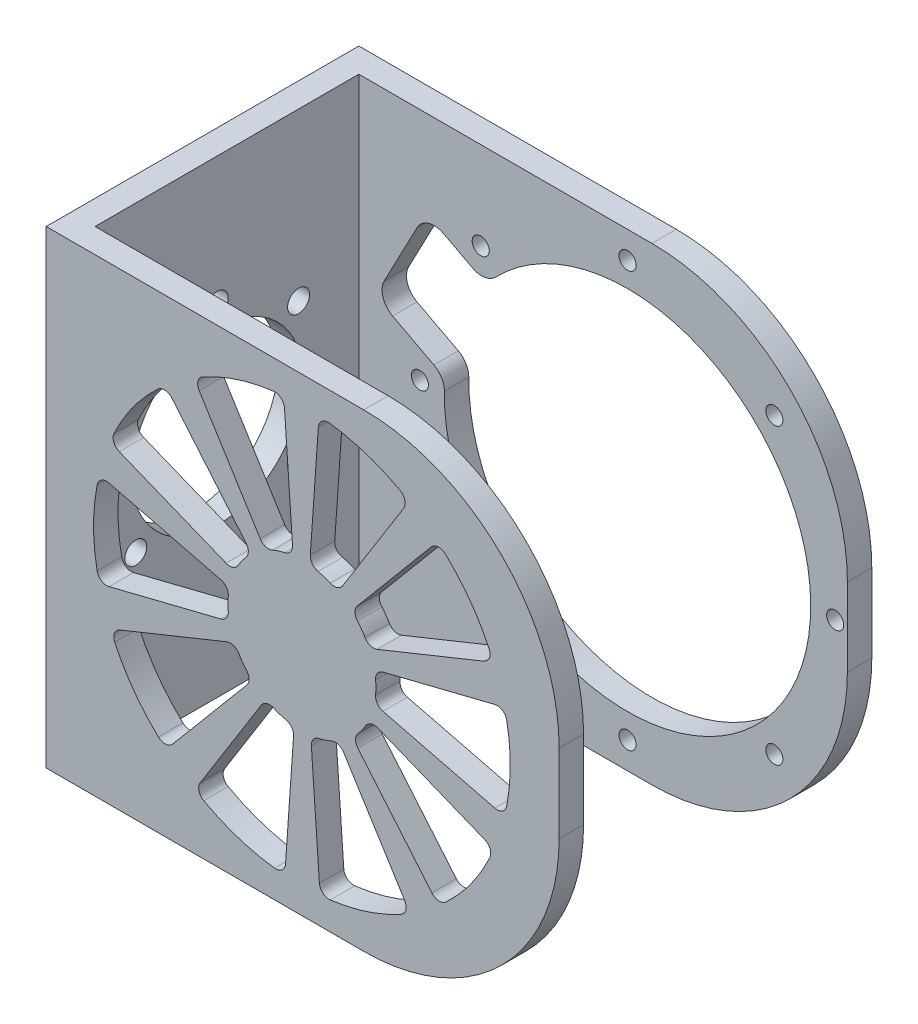
from build123d import *

# Parameters (mm, degrees)
SKETCH_1_W          = 64
SKETCH_1_H          = 96
EXTRUDE_1_DEPTH     = 5
SKETCH_3_W          = 5
SKETCH_3_H          = 96
EXTRUDE_2_DEPTH     = 100
SKETCH_4_R          = 2.25
SKETCH_4_R_2        = 17.5
CUT_EXTRUDE_1_DEPTH = 100
SKETCH_5_R          = 1.75
SKETCH_5_R_2        = 37.5
CUT_EXTRUDE_2_DEPTH = 22
FILLET_1_R          = 40
CUT_EXTRUDE_3_DEPTH = 10
FILLET_2_R          = 4
EXTRUDE_3_DEPTH     = 5
EXTRUDE_4_DEPTH     = 5
CUT_EXTRUDE_4_DEPTH = 5


with BuildPart() as part:
    # 草图1 → 凸台-拉伸1 (new body)
    with BuildSketch(Plane(origin=(0, 0, 0), x_dir=(0, 0, -1), z_dir=(1, 0, 0))):
        Rectangle(SKETCH_1_W, SKETCH_1_H)
    extrude(amount=EXTRUDE_1_DEPTH)

    # 草图3 → 凸台-拉伸2 (add)
    with BuildSketch(Plane(origin=(5, 0, 0), x_dir=(0, 0, -1), z_dir=(1, 0, 0))):
        with Locations((29.5, 0)):
            Rectangle(SKETCH_3_W, SKETCH_3_H)
    extrude(amount=EXTRUDE_2_DEPTH)

    # 草图4 → 切除-拉伸1 (cut)
    with BuildSketch(Plane.ZY):
        with Locations((2, 21.75)):
            Circle(SKETCH_4_R)
        with Locations((18.661466638, 13.980630511)):
            Circle(SKETCH_4_R)
        with Locations(Location((-14.661466638, 13.980630511, 0), (0, 0, 180))):
            Circle(SKETCH_4_R)
        with Locations(Location((2, -21.75, 0), (0, 0, 180))):
            Circle(SKETCH_4_R)
        with Locations(Location((18.661466638, -13.980630511, 0), (0, 0, 180))):
            Circle(SKETCH_4_R)
        with Locations((-14.661466638, -13.980630511)):
            Circle(SKETCH_4_R)
        with Locations((2, 0)):
            Circle(SKETCH_4_R_2)
    extrude(amount=-CUT_EXTRUDE_1_DEPTH, mode=Mode.SUBTRACT)

    # 草图5 → 切除-拉伸2 (cut)
    with BuildSketch(Plane(origin=(0, 0, -32), x_dir=(-1, 0, 0), z_dir=(0, 0, -1))):
        with Locations(Location((-60, 42.5, 0), (0, 0, 90))):
            Circle(SKETCH_5_R)
        with Locations(Location((-29.9479618, 30.0520382, 0), (0, 0, 90))):
            Circle(SKETCH_5_R)
        with Locations(Location((-17.5, 0, 0), (0, 0, 90))):
            Circle(SKETCH_5_R)
        with Locations(Location((-29.9479618, -30.0520382, 0), (0, 0, 90))):
            Circle(SKETCH_5_R)
        with Locations(Location((-60, -42.5, 0), (0, 0, 90))):
            Circle(SKETCH_5_R)
        with Locations(Location((-90.0520382, -30.0520382, 0), (0, 0, 90))):
            Circle(SKETCH_5_R)
        with Locations(Location((-102.5, 0, 0), (0, 0, 90))):
            Circle(SKETCH_5_R)
        with Locations(Location((-90.0520382, 30.0520382, 0), (0, 0, 90))):
            Circle(SKETCH_5_R)
        with Locations(Location((-60, 0, 0), (0, 0, 90))):
            Circle(SKETCH_5_R_2)
    extrude(amount=-CUT_EXTRUDE_2_DEPTH, mode=Mode.SUBTRACT)

    # 圆角1
    fillet_1_edges = [part.edges().sort_by_distance(p)[0] for p in [
        (105, 48, -29.5),
        (105, -48, -29.5),
        (2.5, 48, 32),
        (2.5, -48, 32),
    ]]
    fillet(fillet_1_edges, radius=FILLET_1_R)

    # 草图6 → 切除-拉伸3 (cut)
    with BuildSketch(Plane.XY.offset(-27)):
        with BuildLine():
            Line((10.214665978, 13.994581898), (16.909375695, 26.736126199))
            ThreePointArc((16.909375695, 26.736126199), (19.262083386, 28.695041593), (22.310861308, 28.41658839))
            Line((22.310861308, 28.41658839), (38.87601299, 19.712864625))
            Line((38.87601299, 19.712864625), (28.460279851, -0.11062748))
            Line((28.460279851, -0.11062748), (11.895128168, 8.593096285))
            ThreePointArc((11.895128168, 8.593096285), (9.936212774, 10.945803977), (10.214665978, 13.994581898))
        make_face()
    extrude(amount=-CUT_EXTRUDE_3_DEPTH, mode=Mode.SUBTRACT)

    # 圆角2
    fillet_2_edges = [part.edges().sort_by_distance(p)[0] for p in [
        (31.043675088, 23.82816081, -29.5),
        (22.616971057, 2.959585615, -29.5),
    ]]
    fillet(fillet_2_edges, radius=FILLET_2_R)

    # 草图7 → 凸台-拉伸3 (add)
    with BuildSketch(Plane(origin=(5, 0, 0), x_dir=(0, 0, -1), z_dir=(1, 0, 0))):
        with BuildLine():
            Line((8, 48), (-27, 48))
            Line((-27, 48), (-32, 48))
            Line((-32, 48), (-32, 8))
            ThreePointArc((-32, 8), (-20.284271247, 36.284271247), (8, 48))
        make_face()
        with BuildLine():
            ThreePointArc((8, -48), (-20.284271247, -36.284271247), (-32, -8))
            Line((-32, -8), (-32, -48))
            Line((-32, -48), (-27, -48))
            Line((-27, -48), (8, -48))
        make_face()
    extrude(amount=-EXTRUDE_3_DEPTH)

    # 草图8 → 凸台-拉伸4 (add)
    with BuildSketch(Plane.XY.offset(32)):
        with BuildLine():
            Line((5, -48), (65, -48))
            ThreePointArc((65, -48), (93.284271247, -36.284271247), (105, -8))
            Line((105, -8), (105, 8))
            ThreePointArc((105, 8), (93.284271247, 36.284271247), (65, 48))
            Line((65, 48), (5, 48))
            Line((5, 48), (5, -48))
        make_face()
    extrude(amount=-EXTRUDE_4_DEPTH)

    # 草图9 → 切除-拉伸4 (cut)
    with BuildSketch(Plane.XY.offset(32)):
        with BuildLine():
            Line((68.934811463, 3.474338712), (91.820133988, 9.180290472))
            ThreePointArc((91.820133988, 9.180290472), (93.378826653, 8.926322835), (94.26734503, 7.620735809))
            ThreePointArc((94.26734503, 7.620735809), (95, 0), (94.26734503, -7.620735809))
            ThreePointArc((94.26734503, -7.620735809), (93.378826653, -8.926322835), (91.820133988, -9.180290472))
            Line((91.820133988, -9.180290472), (68.934811463, -3.474338712))
            ThreePointArc((68.934811463, -3.474338712), (67.77963213, -2.679872557), (67.429875219, -1.322195913))
            ThreePointArc((67.429875219, -1.322195913), (67.5, 0), (67.429875219, 1.322195913))
            ThreePointArc((67.429875219, 1.322195913), (67.77963213, 2.679872557), (68.934811463, 3.474338712))
        make_face()
        with BuildLine():
            Line((67.875366835, -6.960104882), (89.743855973, -15.795548013))
            ThreePointArc((89.743855973, -15.795548013), (90.855586398, -16.917188709), (90.807008065, -18.495688799))
            ThreePointArc((90.807008065, -18.495688799), (86.920382266, -25.091637364), (81.848295824, -30.826298358))
            ThreePointArc((81.848295824, -30.826298358), (80.362064559, -31.360282451), (78.951777271, -30.649570023))
            Line((78.951777271, -30.649570023), (63.791036722, -12.581703006))
            ThreePointArc((63.791036722, -12.581703006), (63.323452499, -11.259969009), (63.838515523, -9.956003578))
            ThreePointArc((63.838515523, -9.956003578), (64.672414921, -8.927542926), (65.39285004, -7.816645651))
            ThreePointArc((65.39285004, -7.816645651), (66.473831633, -6.923844127), (67.875366835, -6.960104882))
        make_face()
        with BuildLine():
            Line((60.885046066, -14.779021148), (73.38368225, -34.7810202))
            ThreePointArc((73.38368225, -34.7810202), (73.623807197, -36.341905332), (72.656687427, -37.590385103))
            ThreePointArc((72.656687427, -37.590385103), (65.635339813, -40.642118261), (58.161186526, -42.300258852))
            ThreePointArc((58.161186526, -42.300258852), (56.644932199, -41.858676239), (55.921732101, -40.454751738))
            Line((55.921732101, -40.454751738), (54.276461122, -16.926280561))
            ThreePointArc((54.276461122, -16.926280561), (54.67507329, -15.582136185), (55.85821968, -14.82995244))
            ThreePointArc((55.85821968, -14.82995244), (57.137372468, -14.488064063), (58.373185758, -14.012790426))
            ThreePointArc((58.373185758, -14.012790426), (59.772493806, -13.925883859), (60.885046066, -14.779021148))
        make_face()
        with BuildLine():
            Line((50.633914097, -16.995849828), (48.988643118, -40.524321005))
            ThreePointArc((48.988643118, -40.524321005), (48.265443019, -41.928245506), (46.749188693, -42.36982812))
            ThreePointArc((46.749188693, -42.36982812), (39.275035406, -40.711687528), (32.253687792, -37.65995437))
            ThreePointArc((32.253687792, -37.65995437), (31.286568022, -36.4114746), (31.526692969, -34.850589467))
            Line((31.526692969, -34.850589467), (44.025329153, -14.848590416))
            ThreePointArc((44.025329153, -14.848590416), (45.137881413, -13.995453126), (46.537189461, -14.082359693))
            ThreePointArc((46.537189461, -14.082359693), (47.773002751, -14.55763333), (49.052155539, -14.899521708))
            ThreePointArc((49.052155539, -14.899521708), (50.235301929, -15.651705452), (50.633914097, -16.995849828))
        make_face()
        with BuildLine():
            Line((41.037554918, -12.763837713), (25.876814368, -30.83170473))
            ThreePointArc((25.876814368, -30.83170473), (24.466527081, -31.542417157), (22.980295815, -31.008433064))
            ThreePointArc((22.980295815, -31.008433064), (17.908209373, -25.273772071), (14.021583575, -18.677823506))
            ThreePointArc((14.021583575, -18.677823506), (13.973005242, -17.099323416), (15.084735666, -15.97768272))
            Line((15.084735666, -15.97768272), (36.953224805, -7.142239589))
            ThreePointArc((36.953224805, -7.142239589), (38.354760007, -7.105978834), (39.4357416, -7.998780357))
            ThreePointArc((39.4357416, -7.998780357), (40.156176719, -9.109677633), (40.990076117, -10.138138285))
            ThreePointArc((40.990076117, -10.138138285), (41.505139141, -11.442103716), (41.037554918, -12.763837713))
        make_face()
        with BuildLine():
            Line((35.761451566, -3.699469591), (12.876129042, -9.40542135))
            ThreePointArc((12.876129042, -9.40542135), (11.317436376, -9.151453714), (10.428917999, -7.845866688))
            ThreePointArc((10.428917999, -7.845866688), (9.696263029, -0.225130879), (10.428917999, 7.395604931))
            ThreePointArc((10.428917999, 7.395604931), (11.317436376, 8.701191956), (12.876129042, 8.955159593))
            Line((12.876129042, 8.955159593), (35.761451566, 3.249207833))
            ThreePointArc((35.761451566, 3.249207833), (36.9166309, 2.454741678), (37.26638781, 1.097065035))
            ThreePointArc((37.26638781, 1.097065035), (37.196263029, -0.225130879), (37.26638781, -1.547326792))
            ThreePointArc((37.26638781, -1.547326792), (36.9166309, -2.905003436), (35.761451566, -3.699469591))
        make_face()
        with BuildLine():
            Line((36.820896194, 6.734974003), (14.952407056, 15.570417134))
            ThreePointArc((14.952407056, 15.570417134), (13.840676632, 16.69205783), (13.889254964, 18.27055792))
            ThreePointArc((13.889254964, 18.27055792), (17.775880763, 24.866506486), (22.847967205, 30.601167479))
            ThreePointArc((22.847967205, 30.601167479), (24.334198471, 31.135151572), (25.744485758, 30.424439144))
            Line((25.744485758, 30.424439144), (40.905226307, 12.356572128))
            ThreePointArc((40.905226307, 12.356572128), (41.37281053, 11.034838131), (40.857747506, 9.730872699))
            ThreePointArc((40.857747506, 9.730872699), (40.023848108, 8.702412047), (39.303412989, 7.591514772))
            ThreePointArc((39.303412989, 7.591514772), (38.222431396, 6.698713248), (36.820896194, 6.734974003))
        make_face()
        with BuildLine():
            Line((43.811216964, 14.553890269), (31.312580779, 34.555889321))
            ThreePointArc((31.312580779, 34.555889321), (31.072455832, 36.116774453), (32.039575602, 37.365254224))
            ThreePointArc((32.039575602, 37.365254224), (39.060923216, 40.416987382), (46.535076503, 42.075127974))
            ThreePointArc((46.535076503, 42.075127974), (48.05133083, 41.63354536), (48.774530928, 40.229620859))
            Line((48.774530928, 40.229620859), (50.419801908, 16.701149682))
            ThreePointArc((50.419801908, 16.701149682), (50.021189739, 15.357005306), (48.83804335, 14.604821561))
            ThreePointArc((48.83804335, 14.604821561), (47.558890562, 14.262933184), (46.323077271, 13.787659547))
            ThreePointArc((46.323077271, 13.787659547), (44.923769223, 13.70075298), (43.811216964, 14.553890269))
        make_face()
        with BuildLine():
            Line((54.062348932, 16.770718949), (55.707619912, 40.299190126))
            ThreePointArc((55.707619912, 40.299190126), (56.43082001, 41.703114627), (57.947074337, 42.144697241))
            ThreePointArc((57.947074337, 42.144697241), (65.421227624, 40.486556649), (72.442575238, 37.434823492))
            ThreePointArc((72.442575238, 37.434823492), (73.409695008, 36.186343721), (73.169570061, 34.625458588))
            Line((73.169570061, 34.625458588), (60.670933876, 14.623459537))
            ThreePointArc((60.670933876, 14.623459537), (59.558381617, 13.770322248), (58.159073569, 13.857228815))
            ThreePointArc((58.159073569, 13.857228815), (56.923260279, 14.332502451), (55.64410749, 14.674390829))
            ThreePointArc((55.64410749, 14.674390829), (54.460961101, 15.426574573), (54.062348932, 16.770718949))
        make_face()
        with BuildLine():
            Line((63.658708112, 12.538706835), (78.819448661, 30.606573851))
            ThreePointArc((78.819448661, 30.606573851), (80.229735948, 31.317286279), (81.715967214, 30.783302186))
            ThreePointArc((81.715967214, 30.783302186), (86.788053656, 25.048641192), (90.674679455, 18.452692627))
            ThreePointArc((90.674679455, 18.452692627), (90.723257787, 16.874192537), (89.611527363, 15.752551841))
            Line((89.611527363, 15.752551841), (67.743038224, 6.91710871))
            ThreePointArc((67.743038224, 6.91710871), (66.341503023, 6.880847955), (65.26052143, 7.773649479))
            ThreePointArc((65.26052143, 7.773649479), (64.540086311, 8.884546754), (63.706186913, 9.913007406))
            ThreePointArc((63.706186913, 9.913007406), (63.191123889, 11.216972838), (63.658708112, 12.538706835))
        make_face()
    extrude(amount=-CUT_EXTRUDE_4_DEPTH, mode=Mode.SUBTRACT)


solid = part.part
